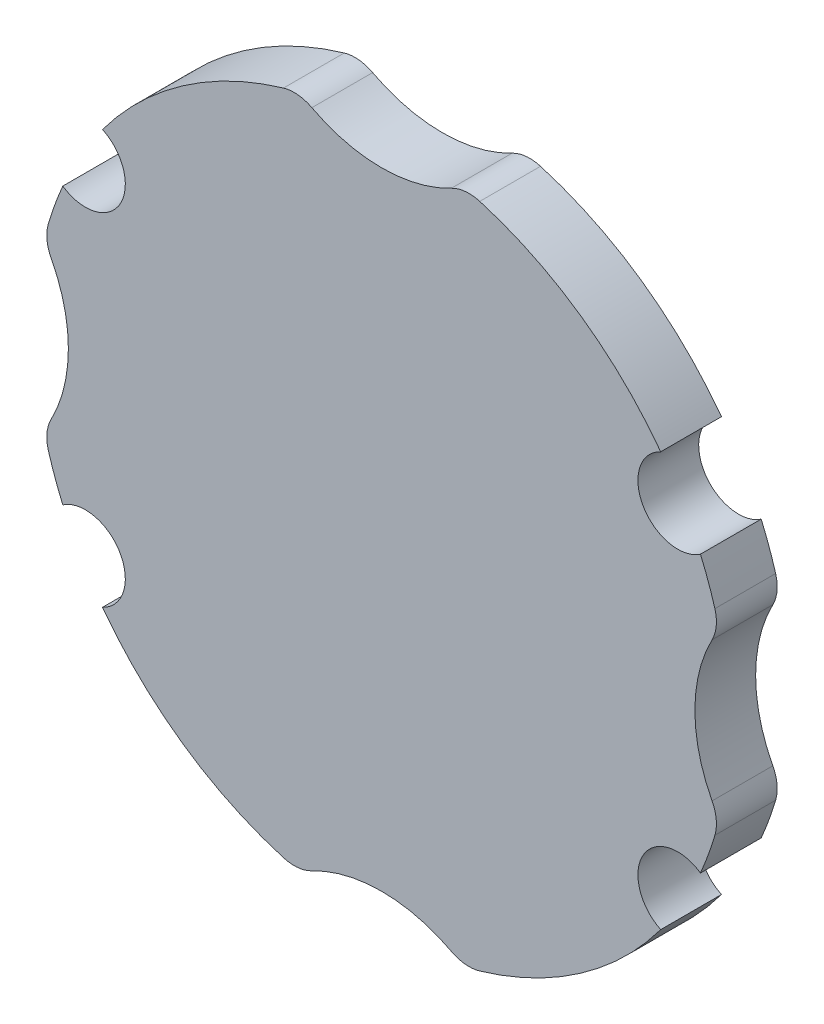
from build123d import *

# Parameters (mm, degrees)
BOSS_EXTRUDE1_DEPTH = 1.6
FILLET1_R           = 1
SKETCH2_R           = 1.05
CUT_EXTRUDE1_DEPTH  = 13.572804314


with BuildPart() as part:
    # Sketch1 → Boss-Extrude1 (new body)
    with BuildSketch(Plane.XY):
        with BuildLine():
            ThreePointArc((2.158317505, -8.891803279), (6.470027048, -6.470027048), (8.891803279, -2.158317505))
            ThreePointArc((8.891803279, -2.158317505), (8.25, 0), (8.891803279, 2.158317505))
            ThreePointArc((8.891803279, 2.158317505), (6.470027048, 6.470027048), (2.158317505, 8.891803279))
            ThreePointArc((2.158317505, 8.891803279), (0, 8.25), (-2.158317505, 8.891803279))
            ThreePointArc((-2.158317505, 8.891803279), (-6.470027048, 6.470027048), (-8.891803279, 2.158317505))
            ThreePointArc((-8.891803279, 2.158317505), (-8.25, 0), (-8.891803279, -2.158317505))
            ThreePointArc((-8.891803279, -2.158317505), (-6.470027048, -6.470027048), (-2.158317505, -8.891803279))
            ThreePointArc((-2.158317505, -8.891803279), (0, -8.25), (2.158317505, -8.891803279))
        make_face()
    extrude(amount=BOSS_EXTRUDE1_DEPTH)

    # Fillet1
    fillet1_edges = [part.edges().sort_by_distance(p)[0] for p in [
        (-2.158317505, -8.891803279, 0.8),
        (-8.891803279, -2.158317505, 0.8),
        (-8.891803279, 2.158317505, 0.8),
        (-2.158317505, 8.891803279, 0.8),
        (2.158317505, 8.891803279, 0.8),
        (8.891803279, 2.158317505, 0.8),
        (8.891803279, -2.158317505, 0.8),
        (2.158317505, -8.891803279, 0.8),
    ]]
    fillet(fillet1_edges, radius=FILLET1_R)

    # Sketch2 → Cut-Extrude1 (cut, through all)
    with BuildSketch(Plane.XY.offset(1.6)):
        with Locations((7.8, 4.5)):
            Circle(SKETCH2_R)
        with Locations((7.8, -4.5)):
            Circle(SKETCH2_R)
        with Locations((-7.8, -4.5)):
            Circle(SKETCH2_R)
        with Locations((-7.8, 4.5)):
            Circle(SKETCH2_R)
    extrude(amount=-CUT_EXTRUDE1_DEPTH, mode=Mode.SUBTRACT)


solid = part.part
